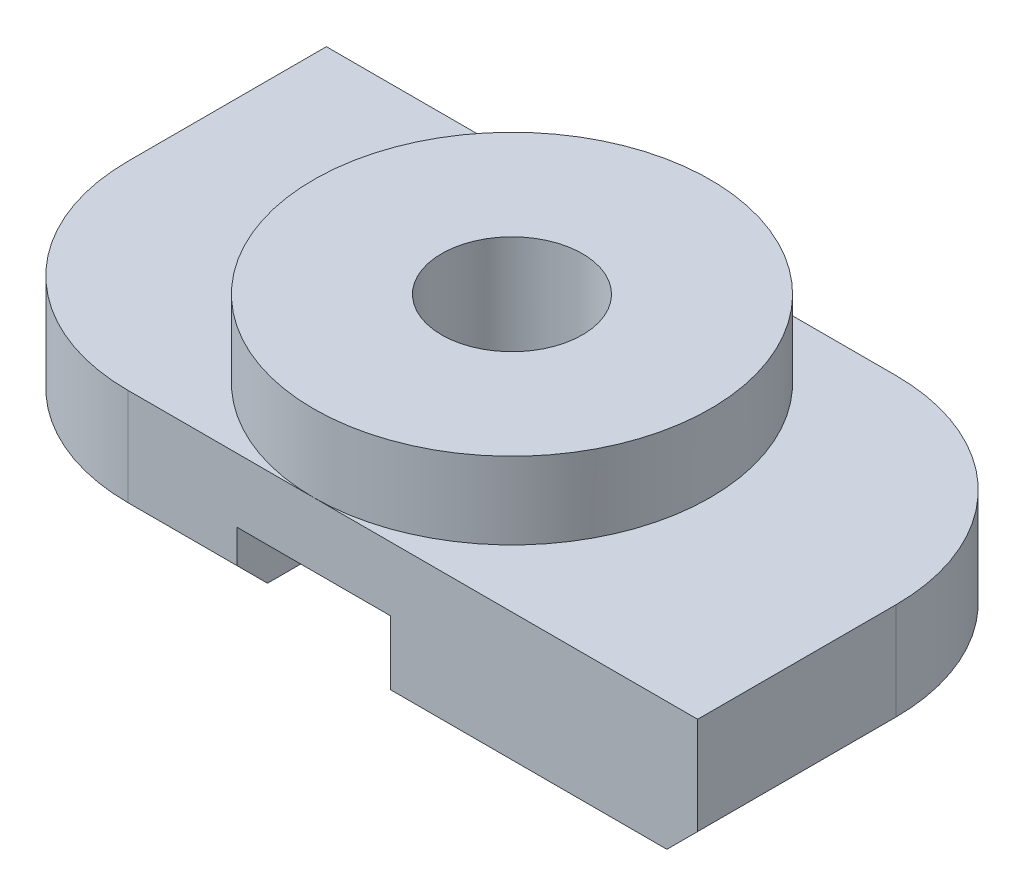
from build123d import *

# Parameters (mm, degrees)
SKETCH1_W           = 15.24
SKETCH1_H           = 7.874
BOSS_EXTRUDE1_DEPTH = 2.54
SKETCH2_R           = 3.937
BOSS_EXTRUDE2_DEPTH = 1.524
SKETCH3_R           = 1.397
CUT_EXTRUDE1_DEPTH  = 18.628771143
FILLET1_R           = 3.937
SKETCH4_W           = 3.048
SKETCH4_H           = 7.874
CUT_EXTRUDE2_DEPTH  = 1.27
CHAMFER1_SIZE       = 0.6096


with BuildPart() as part:
    # Sketch1 → Boss-Extrude1 (new body)
    with BuildSketch(Plane(origin=(0, 0, 0), x_dir=(1, 0, 0), z_dir=(0, 1, 0))):
        with Locations((7.62, 3.937)):
            Rectangle(SKETCH1_W, SKETCH1_H)
    extrude(amount=BOSS_EXTRUDE1_DEPTH)

    # Sketch2 → Boss-Extrude2 (add)
    with BuildSketch(Plane(origin=(0, 2.54, 0), x_dir=(1, 0, 0), z_dir=(0, 1, 0))):
        with Locations(Location((7.62, 3.937, 0), (0, 0, 270))):
            Circle(SKETCH2_R)
    extrude(amount=BOSS_EXTRUDE2_DEPTH)

    # Sketch3 → Cut-Extrude1 (cut, through all)
    with BuildSketch(Plane(origin=(0, 4.064, 0), x_dir=(1, 0, 0), z_dir=(0, 1, 0))):
        with Locations(Location((7.62, 3.937, 0), (0, 0, 270))):
            Circle(SKETCH3_R)
    extrude(amount=-CUT_EXTRUDE1_DEPTH, mode=Mode.SUBTRACT)

    # Fillet1
    fillet1_edges = [part.edges().sort_by_distance(p)[0] for p in [
        (15.24, 1.27, -7.874),
        (0, 1.27, 0),
    ]]
    fillet(fillet1_edges, radius=FILLET1_R)

    # Sketch4 → Cut-Extrude2 (cut)
    with BuildSketch(Plane.XZ):
        with Locations((7.62, -3.937)):
            Rectangle(SKETCH4_W, SKETCH4_H)
    extrude(amount=-CUT_EXTRUDE2_DEPTH, mode=Mode.SUBTRACT)

    # Chamfer1
    chamfer1_edges = [part.edges().sort_by_distance(p)[0] for p in [
        (10.2235, 0, -7.874),
        (14.086879398, 0, -6.720879398),
        (15.24, 0, -1.9685),
        (5.0165, 0, 0),
        (1.153120602, 0, -1.153120602),
        (0, 0, -5.9055),
    ]]
    chamfer(chamfer1_edges, length=CHAMFER1_SIZE)


solid = part.part
